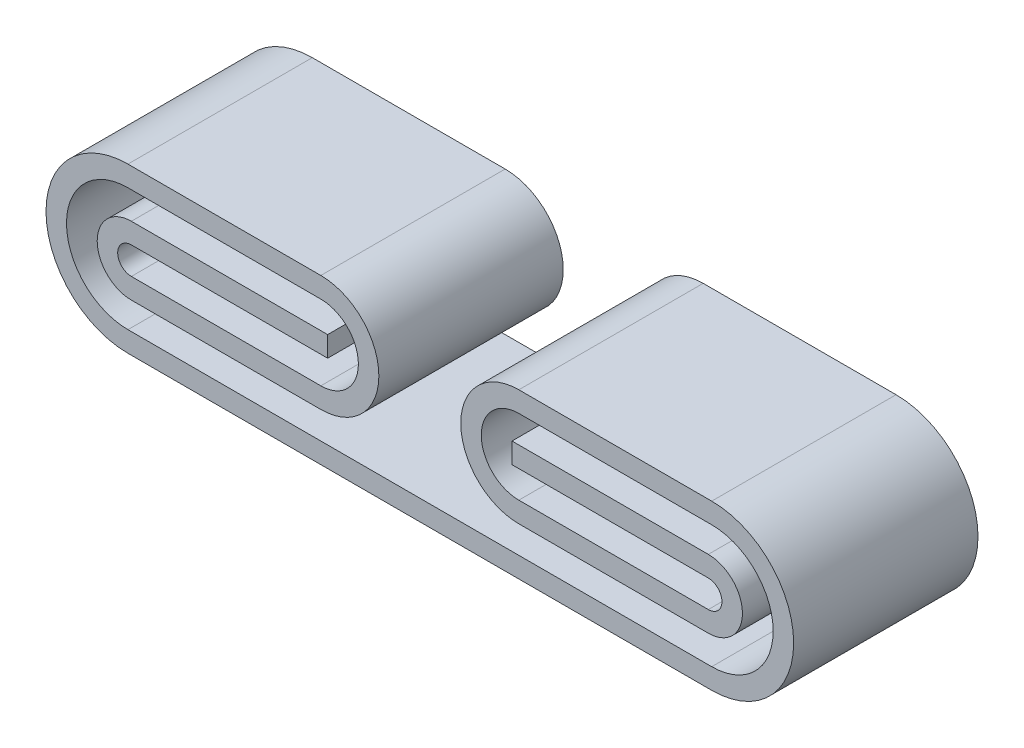
from build123d import *

# Parameters (mm, degrees)
BOSS_EXTRUDE2_START = -5
BOSS_EXTRUDE2_DEPTH = 9


with BuildPart() as part:
    # Sketch1 → Boss-Extrude2 (new body)
    with BuildSketch(Plane.XY.offset(BOSS_EXTRUDE2_START)):
        with BuildLine():
            ThreePointArc((-14.25, 1), (-17.25, 4), (-14.25, 7))
            Line((-14.25, 7), (-4.833333322, 7))
            ThreePointArc((-4.833333322, 7), (-3, 5.166666661), (-4.833333333, 3.333333333))
            Line((-4.833333333, 3.333333333), (-14.083333333, 3.333333333))
            ThreePointArc((-14.083333333, 3.333333333), (-14.75, 4), (-14.083333333, 4.666666667))
            Line((-14.083333333, 4.666666667), (-4.5, 4.666666667))
            Line((-4.5, 4.666666667), (-4.5, 5.666666667))
            Line((-4.5, 5.666666667), (-14.083333333, 5.666666667))
            ThreePointArc((-14.083333333, 5.666666667), (-15.75, 4), (-14.083333333, 2.333333333))
            Line((-14.083333333, 2.333333333), (-4.833333333, 2.333333333))
            ThreePointArc((-4.833333333, 2.333333333), (-2, 5.166666667), (-4.833333333, 8))
            Line((-4.833333333, 8), (-14.25, 8))
            ThreePointArc((-14.25, 8), (-18.25, 4), (-14.25, 0))
            Line((-14.25, 0), (0, 0))
            Line((0, 0), (0, 1))
            Line((0, 1), (-14.25, 1))
        make_face()
    boss_extrude2 = extrude(amount=BOSS_EXTRUDE2_DEPTH)

    # Mirror1: Boss-Extrude2 across plane
    add(boss_extrude2.mirror(Plane(origin=(0, 0, 0), x_dir=(0, 0, 1), z_dir=(1, 0, 0))))


solid = part.part
